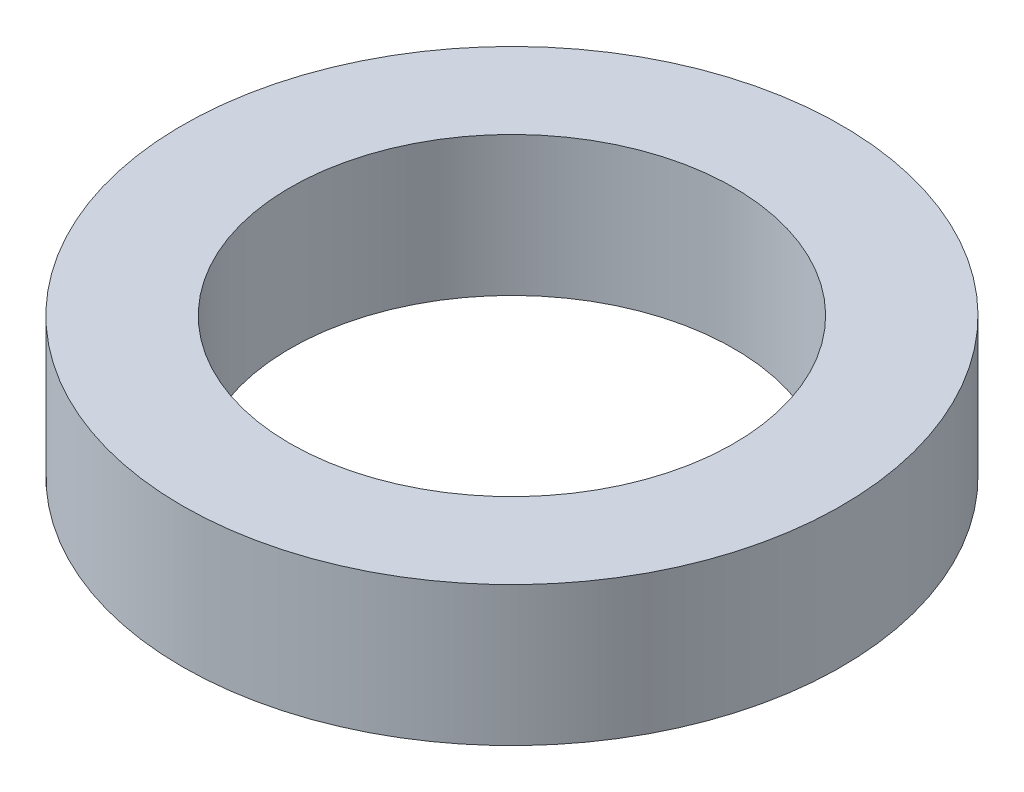
from build123d import *

# Parameters (mm, degrees)
SKETCH1_R           = 26
SKETCH1_R_2         = 17.5
BOSS_EXTRUDE1_DEPTH = 11


with BuildPart() as part:
    # Sketch1 → Boss-Extrude1 (new body)
    with BuildSketch(Plane(origin=(0, 0, 0), x_dir=(1, 0, 0), z_dir=(0, 1, 0))):
        with Locations(Location((0, 0, 0), (0, 0, 270))):
            Circle(SKETCH1_R)
        with Locations(Location((0, 0, 0), (0, 0, 270))):
            Circle(SKETCH1_R_2, mode=Mode.SUBTRACT)
    extrude(amount=BOSS_EXTRUDE1_DEPTH)


solid = part.part
